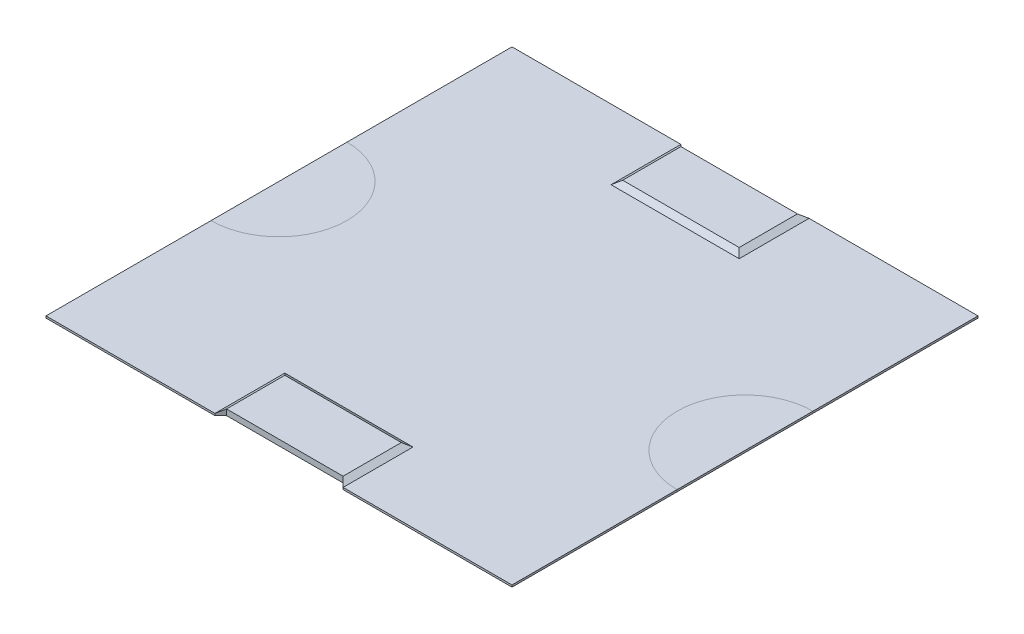
from build123d import *

# Parameters (mm, degrees)
EXTRUDE_18_DEPTH = 10
EXTRUDE_21_DEPTH = 10
EXTRUDE_22_DEPTH = 10
SKETCH_1_27_W    = 600
SKETCH_1_27_H    = 300
EXTRUDE_24_DEPTH = 30
SKETCH_1_28_W    = 600
SKETCH_1_28_H    = 300
EXTRUDE_25_DEPTH = 30


with BuildPart() as part:
    # 草图1<20> → 凸台-拉伸18 (new body)
    with BuildSketch(Plane(origin=(0, 0, 0), x_dir=(1, 0, 0), z_dir=(0, 1, 0))):
        with BuildLine():
            Line((0, 850), (0, 0))
            Line((0, 0), (870, 0))
            Line((870, 0), (870, 360))
            Line((870, 360), (1530, 360))
            Line((1530, 360), (1530, 0))
            Line((1530, 0), (2400, 0))
            Line((2400, 0), (2400, 850))
            ThreePointArc((2400, 850), (2050, 1200), (2400, 1550))
            Line((2400, 1550), (2400, 2400))
            Line((2400, 2400), (1530, 2400))
            Line((1530, 2400), (1530, 2040))
            Line((1530, 2040), (870, 2040))
            Line((870, 2040), (870, 2400))
            Line((870, 2400), (0, 2400))
            Line((0, 2400), (0, 1550))
            ThreePointArc((0, 1550), (350, 1200), (0, 850))
        make_face()
    extrude(amount=EXTRUDE_18_DEPTH)



with BuildPart() as body_2:
    # 草图1<23> → 凸台-拉伸21 (new body)
    with BuildSketch(Plane(origin=(0, 0, 0), x_dir=(1, 0, 0), z_dir=(0, 1, 0))):
        with BuildLine():
            Line((0, 1550), (0, 850))
            ThreePointArc((0, 850), (350, 1200), (0, 1550))
        make_face()
    extrude(amount=EXTRUDE_21_DEPTH)


with BuildPart() as body_3:
    # 草图1 → 凸台-拉伸22 (new body)
    with BuildSketch(Plane(origin=(0, 0, 0), x_dir=(1, 0, 0), z_dir=(0, 1, 0))):
        with BuildLine():
            ThreePointArc((2400, 1550), (2050, 1200), (2400, 850))
            Line((2400, 850), (2400, 1550))
        make_face()
    extrude(amount=EXTRUDE_22_DEPTH)


with BuildPart() as body_4:
    # 草图1<27> → 凸台-拉伸24 (new body)
    with BuildSketch(Plane(origin=(0, 0, 0), x_dir=(1, 0, 0), z_dir=(0, 1, 0))):
        with Locations((1200, 180)):
            Rectangle(SKETCH_1_27_W, SKETCH_1_27_H)
    extrude(amount=EXTRUDE_24_DEPTH)


with BuildPart() as part_1:
    add(part.part)

    add(body_4.part)  # loft_6 joins it to this body
    # loft from a face of the part (loft_6)
    loft([part_1.faces().sort_by_distance((1530, 5, -180))[0], part_1.faces().sort_by_distance((1500, 15, -180))[0]])

    # loft from a face of the part (loft_7)
    loft([part_1.faces().sort_by_distance((900, 15, -180))[0], part_1.faces().sort_by_distance((870, 5, -180))[0]])

    # loft from a face of the part (loft_8)
    loft([part_1.faces().sort_by_distance((1200, 5, -360))[0], part_1.faces().sort_by_distance((1200, 15, -330))[0]])



with BuildPart() as body_4_2:
    # 草图1<28> → 凸台-拉伸25 (new body)
    with BuildSketch(Plane(origin=(0, 0, 0), x_dir=(1, 0, 0), z_dir=(0, 1, 0))):
        with Locations((1200, 2220)):
            Rectangle(SKETCH_1_28_W, SKETCH_1_28_H)
    extrude(amount=EXTRUDE_25_DEPTH)


with BuildPart() as part_2:
    add(part_1.part)

    add(body_4_2.part)  # loft_9 joins it to this body
    # loft from a face of the part (loft_9)
    loft([part_2.faces().sort_by_distance((870, 5, -2220))[0], part_2.faces().sort_by_distance((900, 15, -2220))[0]])

    # loft from a face of the part (loft_10)
    loft([part_2.faces().sort_by_distance((1200, 15, -2070))[0], part_2.faces().sort_by_distance((1200, 5, -2040))[0]])

    # loft from a face of the part (loft_11)
    loft([part_2.faces().sort_by_distance((1500, 15, -2220))[0], part_2.faces().sort_by_distance((1530, 5, -2220))[0]])


solid = Compound([body_2.part, body_3.part, part_2.part])
